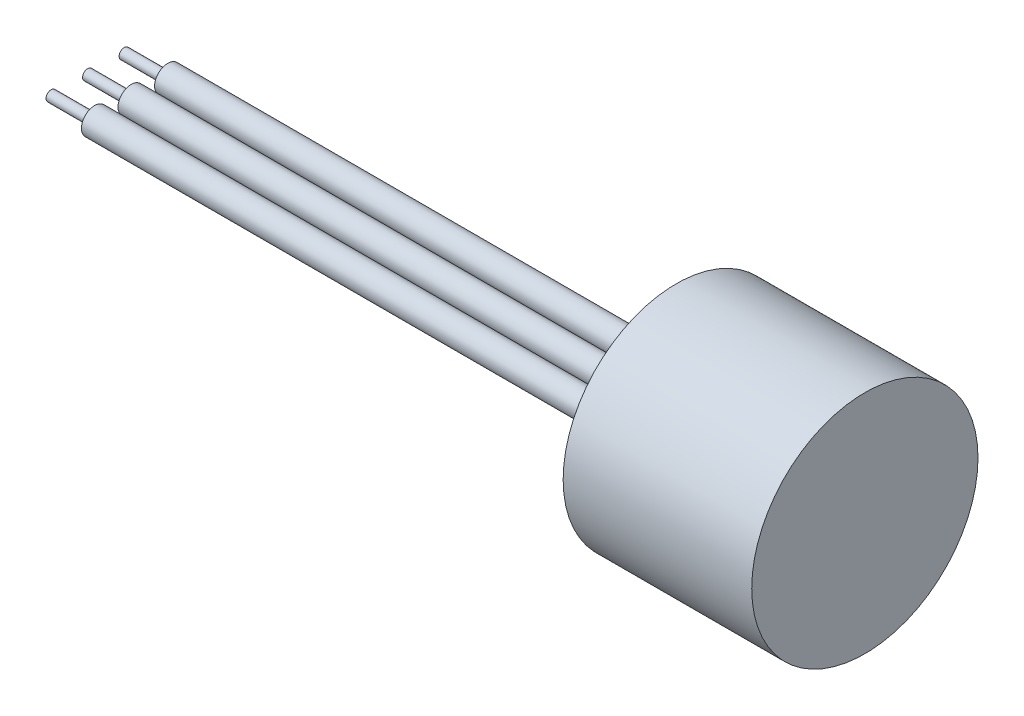
from build123d import *


with BuildPart() as part:
    # Sketch1 → Revolve1 (revolve)
    with BuildSketch(Plane.XY.offset(-0.0942096), mode=Mode.PRIVATE) as revolve1_sk:
        Polygon((35.6108, -12.191773113), (35.6108, -5.080397281), (54.6608, -5.080396955), (54.6608, -2.794255147), (39.0398, -2.794245161), (37.5158, -1.270188911), (37.5158, 0.380874088), (58.4708, 0.380865578), (58.4708, -12.191773113), align=None)
    revolve(revolve1_sk.sketch.rotate(Axis((58.4708, -12.191773113, -0.0942096), (-1, 0, 0)), 270), axis=Axis((58.4708, -12.191773113, -0.0942096), (-1, 0, 0)))

    # Sketch2 → Revolve2 (revolve)
    with BuildSketch(Plane(origin=(0, -12.191772951, 0), x_dir=(1, 0, 0), z_dir=(0, 1, 0)), mode=Mode.PRIVATE) as revolve2_sk:
        Polygon((-27.8892, -3.9697904), (-27.8892, -3.3982904), (-23.0632, -3.3982904), (-23.0632, -2.509290489), (35.6108, -2.509290489), (35.6108, -3.9697904), align=None)
    revolve(revolve2_sk.sketch.rotate(Axis((35.6108, -12.191772951, 3.9697904), (-1, 0, 0)), 180), axis=Axis((35.6108, -12.191772951, 3.9697904), (-1, 0, 0)))

    # Sketch3 → Revolve3 (revolve)
    with BuildSketch(Plane(origin=(0, -12.191772951, 0), x_dir=(1, 0, 0), z_dir=(0, 1, 0)), mode=Mode.PRIVATE) as revolve3_sk:
        Polygon((-27.8892, 4.1582096), (-27.8892, 4.7297096), (-23.0632, 4.7297096), (-23.0632, 5.618709512), (35.6108, 5.618709512), (35.6108, 4.1582096), align=None)
    revolve(revolve3_sk.sketch.rotate(Axis((35.6108, -12.191772951, -4.1582096), (-1, 0, 0)), 180), axis=Axis((35.6108, -12.191772951, -4.1582096), (-1, 0, 0)))

    # Sketch4 → Revolve4 (revolve)
    with BuildSketch(Plane(origin=(0, -12.191772951, 0), x_dir=(1, 0, 0), z_dir=(0, 1, 0)), mode=Mode.PRIVATE) as revolve4_sk:
        Polygon((-27.8892, 0.0942096), (-27.8892, 0.6657096), (-23.0632, 0.6657096), (-23.0632, 1.554709511), (35.6108, 1.554709511), (35.6108, 0.0942096), align=None)
    revolve(revolve4_sk.sketch.rotate(Axis((35.6108, -12.191772951, -0.0942096), (-1, 0, 0)), 180), axis=Axis((35.6108, -12.191772951, -0.0942096), (-1, 0, 0)))


solid = part.part
